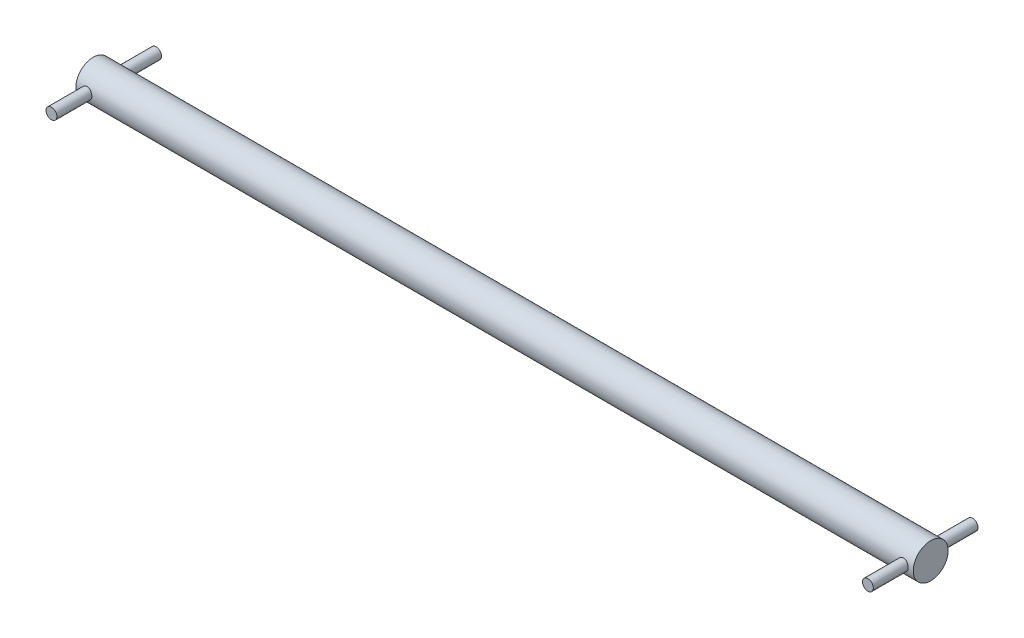
from build123d import *

# Parameters (mm, degrees)
SKETCH1_R           = 12.7
BOSS_EXTRUDE1_DEPTH = 609.6
SKETCH2_R           = 3.96875
BOSS_EXTRUDE2_DEPTH = 38.1


with BuildPart() as part:
    # Sketch1 → Boss-Extrude1 (new body)
    with BuildSketch(Plane(origin=(0, 0, 0), x_dir=(0, 0, -1), z_dir=(1, 0, 0))):
        with Locations(Location((0, 0, 0), (0, 0, 180))):
            Circle(SKETCH1_R)
    extrude(amount=BOSS_EXTRUDE1_DEPTH)

    # Sketch2 → Boss-Extrude2 (add, symmetric)
    with BuildSketch(Plane.XY):
        with Locations((7.62, 0)):
            Circle(SKETCH2_R)
        with Locations(Location((601.98, 0, 0), (0, 0, 180))):
            Circle(SKETCH2_R)
    extrude(amount=BOSS_EXTRUDE2_DEPTH, both=True)


solid = part.part
